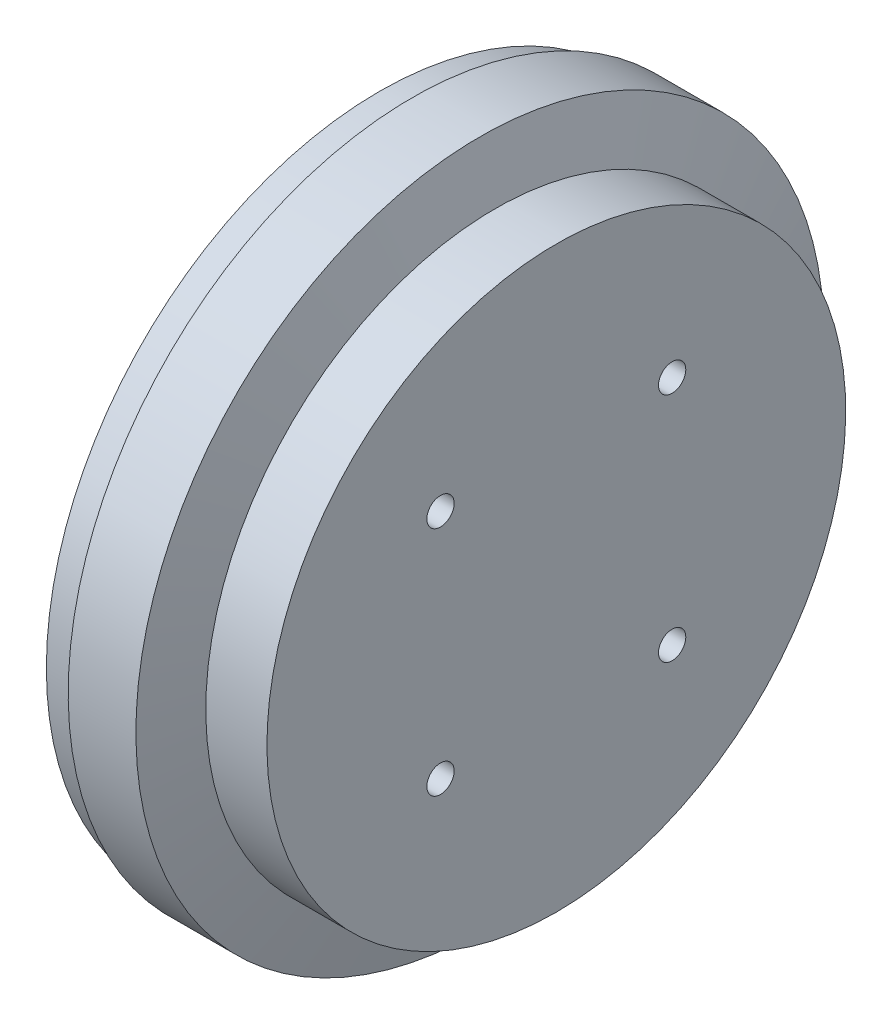
from build123d import *

# Parameters (mm, degrees)
M3X0_5_TAPPED_HOLE1_D     = 2.5
M3X0_5_TAPPED_HOLE1_DEPTH = 7.5
M3X0_5_TAPPED_HOLE1_TIP   = 0.751075774
SKETCH5_R                 = 30.5
BOSS_EXTRUDE1_DEPTH       = 3


with BuildPart() as part:
    # Sketch1 → Revolve1 (revolve)
    with BuildSketch(Plane.XY, mode=Mode.PRIVATE) as revolve1_sk:
        Polygon((-6.6, 0), (6.6, 0), (6.6, 26.5), (1, 26.5), (-0.4, 31.5), (-6.6, 31.5), align=None)
    revolve(revolve1_sk.sketch.rotate(Axis((-6.6, 0, 0), (1, 0, 0)), 180), axis=Axis((-6.6, 0, 0), (1, 0, 0)))

    # M3x0.5 Tapped Hole1
    with Locations(Plane(origin=(6.6, 0, 0), x_dir=(0, 0, -1), z_dir=(1, 0, 0))):
        with Locations((-10.606601718, 10.606601718), (-10.606601718, -10.606601718), (10.606601718, -10.606601718), (10.606601718, 10.606601718)):
            Hole(M3X0_5_TAPPED_HOLE1_D / 2, depth=M3X0_5_TAPPED_HOLE1_DEPTH)
            with Locations((0, 0, -(M3X0_5_TAPPED_HOLE1_DEPTH + M3X0_5_TAPPED_HOLE1_TIP / 2))):  # 118° drill point
                Cone(0, M3X0_5_TAPPED_HOLE1_D / 2, M3X0_5_TAPPED_HOLE1_TIP, mode=Mode.SUBTRACT)

    # Sketch5 → Boss-Extrude1 (add)
    with BuildSketch(Plane.ZY.offset(6.6)):
        with Locations(Location((0, 0, 0), (0, 0, 270))):
            Circle(SKETCH5_R)
    extrude(amount=BOSS_EXTRUDE1_DEPTH)


solid = part.part
